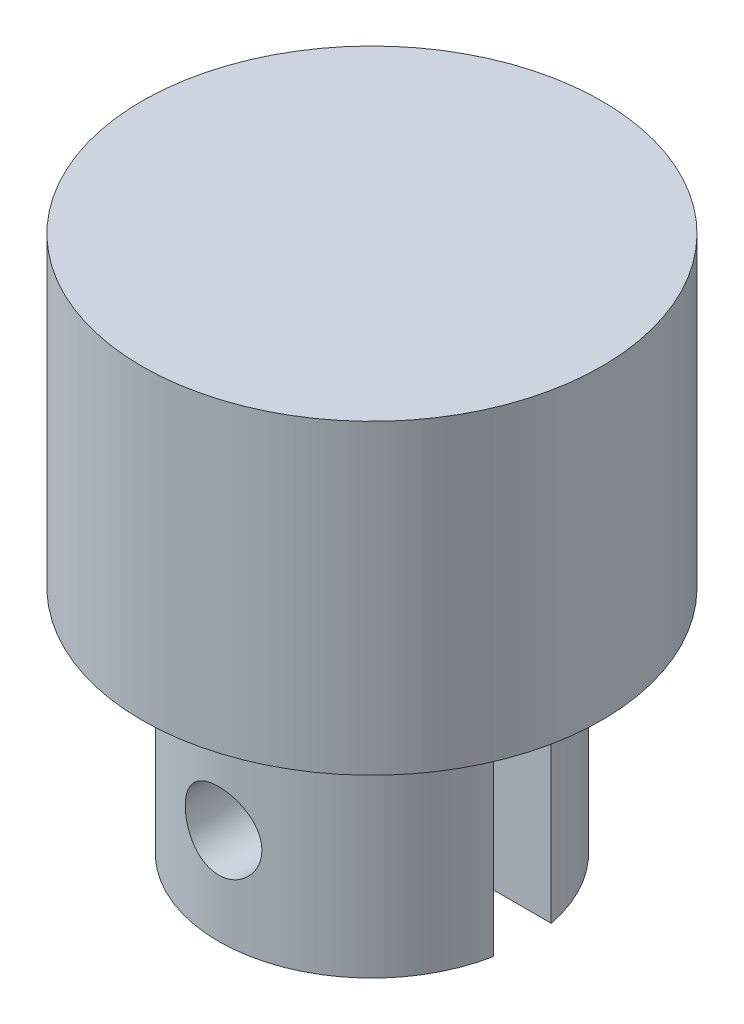
from build123d import *

# Parameters (mm, degrees)
SKETCH1_R                                 = 6
BOSS_EXTRUDE1_DEPTH                       = 4
SKETCH2_R                                 = 4
BOSS_EXTRUDE2_DEPTH                       = 6
F_2_0MM_PRESS_DOWEL_HOLE1_D               = 2
F_2_0MM_PRESS_DOWEL_HOLE1_DEPTH           = 3.25
F_2_0MM_PRESS_DOWEL_HOLE1_TIP             = 0.600860619
F_2_0MM_PRESS_DOWEL_HOLE1_ON_FACE_2_D     = 2
F_2_0MM_PRESS_DOWEL_HOLE1_ON_FACE_2_DEPTH = 3.25
F_2_0MM_PRESS_DOWEL_HOLE1_ON_FACE_2_TIP   = 0.600860619
CUT_EXTRUDE1_DEPTH                        = 14.114877125
CUT_EXTRUDE1_DEPTH_BACK                   = 14.114877125
SKETCH8_W                                 = 1.5
SKETCH8_H                                 = 6


with BuildPart() as part:
    # Sketch1 → Boss-Extrude1 (new, symmetric)
    with BuildSketch(Plane(origin=(0, 0, 0), x_dir=(1, 0, 0), z_dir=(0, 1, 0))):
        with Locations(Location((0, 0, 0), (0, 0, 270))):
            Circle(SKETCH1_R)
    extrude(amount=BOSS_EXTRUDE1_DEPTH, both=True)

    # Sketch2 → Boss-Extrude2 (add)
    with BuildSketch(Plane.XZ.offset(4)):
        with Locations(Location((0, 0, 0), (0, 0, 270))):
            Circle(SKETCH2_R)
    extrude(amount=BOSS_EXTRUDE2_DEPTH)

    # Ø2.0mm Press Dowel Hole1
    with Locations(Plane(origin=(0, -7.5, 4), x_dir=(1, 0, 0), z_dir=(0, 0, 1))):
        with Locations((0, 0)):
            Hole(F_2_0MM_PRESS_DOWEL_HOLE1_D / 2, depth=F_2_0MM_PRESS_DOWEL_HOLE1_DEPTH)
            with Locations((0, 0, -(F_2_0MM_PRESS_DOWEL_HOLE1_DEPTH + F_2_0MM_PRESS_DOWEL_HOLE1_TIP / 2))):  # 118° drill point
                Cone(0, F_2_0MM_PRESS_DOWEL_HOLE1_D / 2, F_2_0MM_PRESS_DOWEL_HOLE1_TIP, mode=Mode.SUBTRACT)

    # Ø2.0mm Press Dowel Hole1 on face 2
    with Locations(Plane(origin=(0, -7.5, -4), x_dir=(-1, 0, 0), z_dir=(0, 0, -1))):
        with Locations((0, 0)):
            Hole(F_2_0MM_PRESS_DOWEL_HOLE1_ON_FACE_2_D / 2, depth=F_2_0MM_PRESS_DOWEL_HOLE1_ON_FACE_2_DEPTH)
            with Locations((0, 0, -(F_2_0MM_PRESS_DOWEL_HOLE1_ON_FACE_2_DEPTH + F_2_0MM_PRESS_DOWEL_HOLE1_ON_FACE_2_TIP / 2))):  # 118° drill point
                Cone(0, F_2_0MM_PRESS_DOWEL_HOLE1_ON_FACE_2_D / 2, F_2_0MM_PRESS_DOWEL_HOLE1_ON_FACE_2_TIP, mode=Mode.SUBTRACT)

    # Sketch8 → Cut-Extrude1 (cut, two sides: drawn at the far end of the back side and taken through both)
    with BuildSketch(Plane(origin=(0, 0, 0), x_dir=(0, 0, -1), z_dir=(1, 0, 0)).offset(-CUT_EXTRUDE1_DEPTH_BACK)):
        with Locations((0, -7)):
            Rectangle(SKETCH8_W, SKETCH8_H)
    extrude(amount=CUT_EXTRUDE1_DEPTH + CUT_EXTRUDE1_DEPTH_BACK, mode=Mode.SUBTRACT)


solid = part.part
